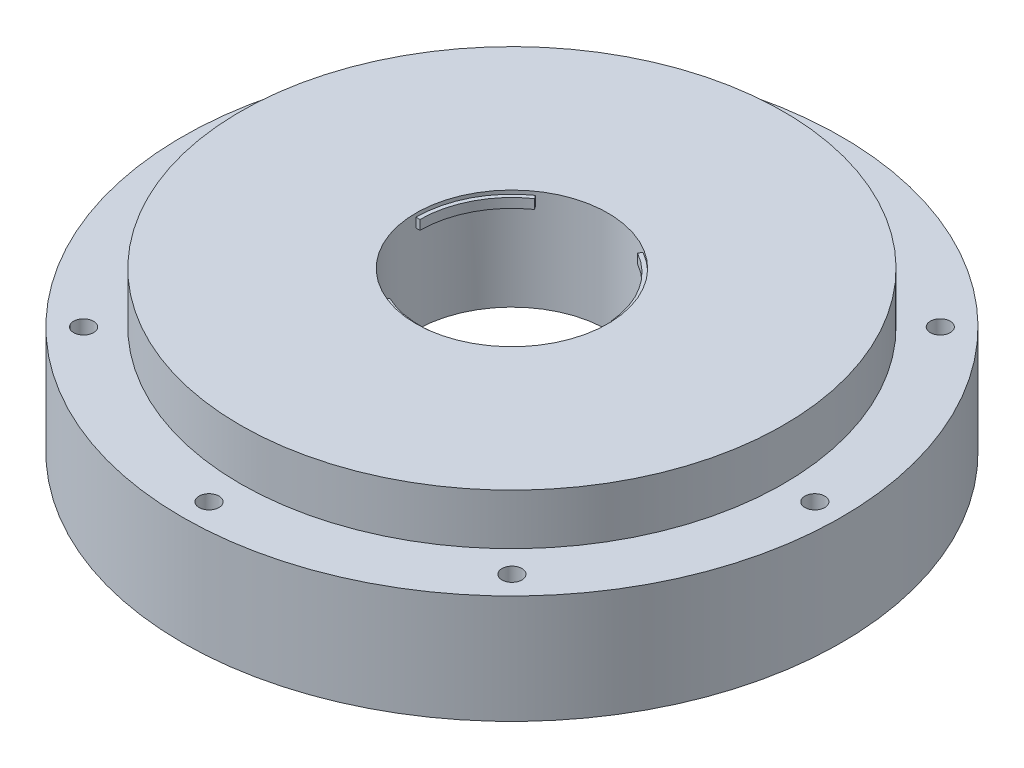
from build123d import *

# Parameters (mm, degrees)
SKETCH1_R                = 91
SKETCH1_R_2              = 65
SKETCH1_R_3              = 2.75
BOSS_EXTRUDE1_DEPTH      = 30
BOSS_EXTRUDE2_DEPTH      = 14
BOSS_EXTRUDE2_DEPTH_BACK = 14
SKETCH2_R                = 75
SKETCH2_R_2              = 26.5
SKETCH5_W                = 1.1
SKETCH5_H                = 2.6
REVOLVE1_ANGLE           = 55
CIRPATTERN1_COUNT        = 3


with BuildPart() as part:
    # Sketch1 → Boss-Extrude1 (new body)
    with BuildSketch(Plane(origin=(0, 0, 0), x_dir=(1, 0, 0), z_dir=(0, 1, 0))):
        with Locations(Location((0, 0, 0), (0, 0, 270))):
            Circle(SKETCH1_R)
        with Locations(Location((0, 0, 0), (0, 0, 270))):
            Circle(SKETCH1_R_2, mode=Mode.SUBTRACT)
        with Locations(Location((0, 83.635, 0), (0, 0, 270))):
            Circle(SKETCH1_R_3, mode=Mode.SUBTRACT)
        with Locations(Location((59.138875645, 59.138875645, 0), (0, 0, 270))):
            Circle(SKETCH1_R_3, mode=Mode.SUBTRACT)
        with Locations(Location((83.635, 0, 0), (0, 0, 270))):
            Circle(SKETCH1_R_3, mode=Mode.SUBTRACT)
        with Locations(Location((59.138875645, -59.138875645, 0), (0, 0, 270))):
            Circle(SKETCH1_R_3, mode=Mode.SUBTRACT)
        with Locations(Location((0, -83.635, 0), (0, 0, 270))):
            Circle(SKETCH1_R_3, mode=Mode.SUBTRACT)
        with Locations(Location((-59.138875645, -59.138875645, 0), (0, 0, 270))):
            Circle(SKETCH1_R_3, mode=Mode.SUBTRACT)
        with Locations(Location((-83.635, 0, 0), (0, 0, 270))):
            Circle(SKETCH1_R_3, mode=Mode.SUBTRACT)
        with Locations(Location((-59.138875645, 59.138875645, 0), (0, 0, 270))):
            Circle(SKETCH1_R_3, mode=Mode.SUBTRACT)
    extrude(amount=BOSS_EXTRUDE1_DEPTH)

    # Sketch2 → Boss-Extrude2 (add, two sides: drawn at the far end of the back side and taken through both)
    with BuildSketch(Plane(origin=(0, 30, 0), x_dir=(1, 0, 0), z_dir=(0, 1, 0)).offset(-BOSS_EXTRUDE2_DEPTH_BACK)):
        with Locations(Location((0, 0, 0), (0, 0, 270))):
            Circle(SKETCH2_R)
        with Locations(Location((0, 0, 0), (0, 0, 270))):
            Circle(SKETCH2_R_2, mode=Mode.SUBTRACT)
    extrude(amount=BOSS_EXTRUDE2_DEPTH + BOSS_EXTRUDE2_DEPTH_BACK)

    # Sketch5 → Revolve1 (revolve)
    with BuildSketch(Plane.XY):
        with Locations((-25.95, 41.7)):
            Rectangle(SKETCH5_W, SKETCH5_H)
    revolve1 = revolve(axis=Axis((0, 48.211759647, 0), (0, -1, 0)), revolution_arc=REVOLVE1_ANGLE)

    # CirPattern1: Revolve1 ×3 about axis
    cirpattern1_axis = Axis((0, 0, 0), (0, 1, 0))
    for i in range(1, CIRPATTERN1_COUNT):
        add(revolve1.rotate(cirpattern1_axis, i * 360 / CIRPATTERN1_COUNT))


solid = part.part
